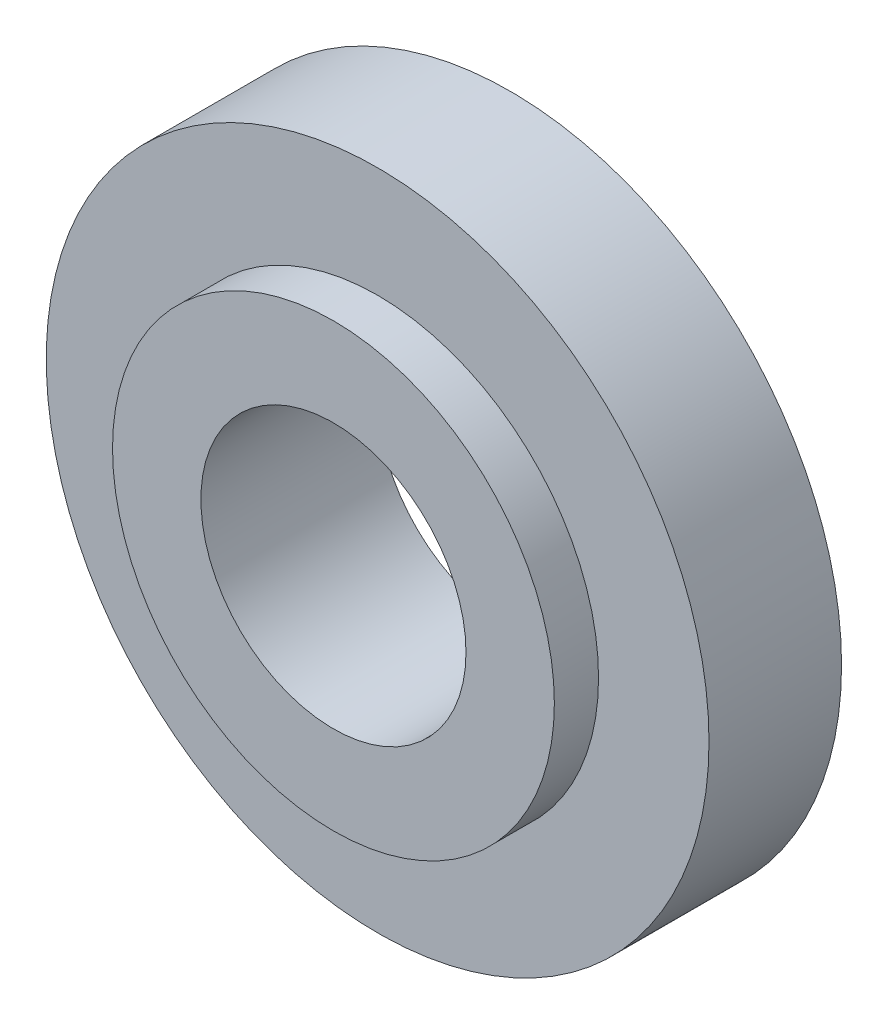
from build123d import *

# Parameters (mm, degrees)
SKETCH1_R           = 3.75
SKETCH1_R_2         = 1.5
BOSS_EXTRUDE2_DEPTH = 1.5
BOSS_EXTRUDE3_START = 0.5
SKETCH1_4_R         = 2.5
SKETCH1_4_R_2       = 1.5
BOSS_EXTRUDE3_DEPTH = 0.5


with BuildPart() as part:
    # Sketch1 → Boss-Extrude2 (new body)
    with BuildSketch(Plane.XY):
        Circle(SKETCH1_R)
        Circle(SKETCH1_R_2, mode=Mode.SUBTRACT)
    extrude(amount=-BOSS_EXTRUDE2_DEPTH)

    # Sketch1<4> → Boss-Extrude3 (add)
    with BuildSketch(Plane.XY.offset(BOSS_EXTRUDE3_START)):
        Circle(SKETCH1_4_R)
        Circle(SKETCH1_4_R_2, mode=Mode.SUBTRACT)
    extrude(amount=-BOSS_EXTRUDE3_DEPTH)


solid = part.part
